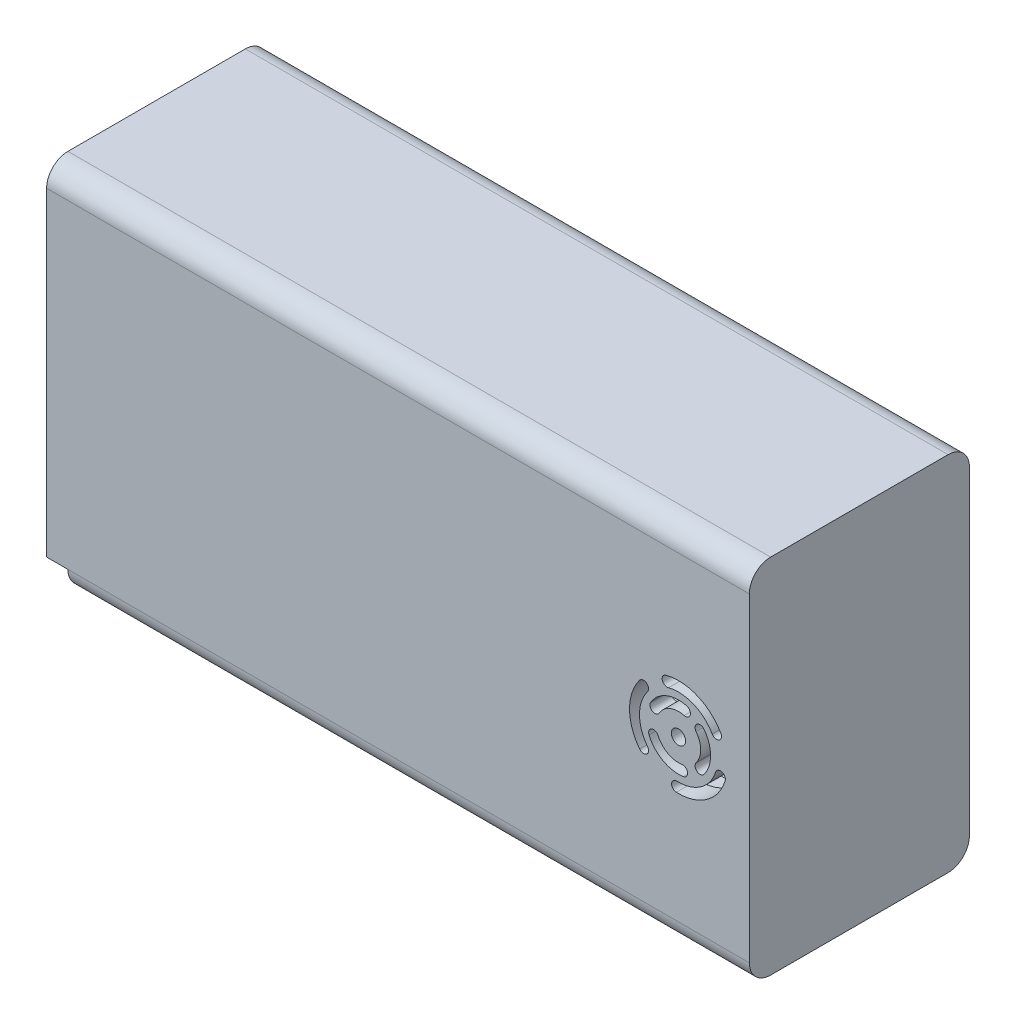
from build123d import *

# Parameters (mm, degrees)
SKETCH1_W           = 99
SKETCH1_H           = 51
BOSS_EXTRUDE2_DEPTH = 31
CUT_EXTRUDE1_DEPTH  = 96
SKETCH4_W           = 3
SKETCH4_H           = 31
CUT_EXTRUDE2_DEPTH  = 3
SKETCH6_W           = 2
SKETCH6_H           = 2
BOSS_EXTRUDE3_DEPTH = 96
SKETCH7_W           = 1
SKETCH7_H           = 1
CUT_EXTRUDE3_DEPTH  = 45
FILLET1_R           = 3
SKETCH9_R           = 1
SKETCH9_R_2         = 0.5
CUT_EXTRUDE4_DEPTH  = 10


with BuildPart() as part:
    # Sketch1 → Boss-Extrude2 (new body)
    with BuildSketch(Plane.XY):
        Rectangle(SKETCH1_W, SKETCH1_H)
    extrude(amount=BOSS_EXTRUDE2_DEPTH)

    # Sketch3 → Cut-Extrude1 (cut)
    with BuildSketch(Plane.ZY.offset(49.5)):
        Polygon((3, 0.616456183), (3, -22.5), (28, -22.5), (28, 22.5), (3, 22.5), align=None)
    extrude(amount=-CUT_EXTRUDE1_DEPTH, mode=Mode.SUBTRACT)

    # Sketch4 → Cut-Extrude2 (cut)
    with BuildSketch(Plane.XZ.offset(25.5)):
        with Locations((-48, 15.5)):
            Rectangle(SKETCH4_W, SKETCH4_H)
    extrude(amount=-CUT_EXTRUDE2_DEPTH, mode=Mode.SUBTRACT)

    # Sketch6 → Boss-Extrude3 (add)
    with BuildSketch(Plane.ZY.offset(46.5)):
        with Locations((13.2, -21.5)):
            Rectangle(SKETCH6_W, SKETCH6_H)
        with Locations((17.8, -21.5)):
            Rectangle(SKETCH6_W, SKETCH6_H)
        with Locations((13.2, 21.5)):
            Rectangle(SKETCH6_W, SKETCH6_H)
        with Locations((17.8, 21.5)):
            Rectangle(SKETCH6_W, SKETCH6_H)
    extrude(amount=-BOSS_EXTRUDE3_DEPTH)

    # Sketch7 → Cut-Extrude3 (cut)
    with BuildSketch(Plane.XZ.offset(22.5)):
        with Locations((-48.055142405, 28.5)):
            Rectangle(SKETCH7_W, SKETCH7_H)
        with Locations((-48.055142405, 2.5)):
            Rectangle(SKETCH7_W, SKETCH7_H)
    extrude(amount=-CUT_EXTRUDE3_DEPTH, mode=Mode.SUBTRACT)

    # Fillet1
    fillet1_edges = [part.edges().sort_by_distance(p)[0] for p in [
        (0, 25.5, 31),
        (1.5, -25.5, 31),
        (1.5, -25.5, 0),
        (0, 25.5, 0),
    ]]
    fillet(fillet1_edges, radius=FILLET1_R)

    # Sketch9 → Cut-Extrude4 (cut)
    # profile 1 of 8: a face of its own
    with BuildSketch(Plane(origin=(0, 0, 28), x_dir=(-1, 0, 0), z_dir=(0, 0, -1))):
        with BuildLine():
            ThreePointArc((-43.107346254, 2.807819217), (-44.043005412, 0.051456221), (-43.107346254, -2.704906774))
            ThreePointArc((-43.107346254, -2.704906774), (-42.125865916, -2.834121112), (-41.996651578, -1.852640773))
            ThreePointArc((-41.996651578, -1.852640773), (-42.643005412, 0.051456221), (-41.996651578, 1.955553216))
            ThreePointArc((-41.996651578, 1.955553216), (-42.125865916, 2.937033554), (-43.107346254, 2.807819217))
        make_face()
    # profile 2 of 8: a face of its own
    with BuildSketch(Plane(origin=(0, 0, 28), x_dir=(-1, 0, 0), z_dir=(0, 0, -1))):
        with BuildLine():
            ThreePointArc((-37.730978714, 6.710201232), (-42.153265918, 6.420349215), (-45.485251514, 3.498276272))
            ThreePointArc((-45.485251514, 3.498276272), (-45.229033732, 2.542058489), (-44.272815949, 2.798276272))
            ThreePointArc((-44.272815949, 2.798276272), (-41.617509112, 5.12691787), (-38.093325377, 5.357905075))
            ThreePointArc((-38.093325377, 5.357905075), (-37.236003967, 5.852879822), (-37.730978714, 6.710201232))
        make_face()
    # profile 3 of 8: a face of its own
    with BuildSketch(Plane(origin=(0, 0, 28), x_dir=(-1, 0, 0), z_dir=(0, 0, -1))):
        with BuildLine():
            ThreePointArc((-35.59397575, 2.315366896), (-35.850193532, 1.359149114), (-36.806411315, 1.615366896))
            ThreePointArc((-36.806411315, 1.615366896), (-38.318218652, 2.941186348), (-40.324723797, 3.072699643))
            ThreePointArc((-40.324723797, 3.072699643), (-41.182045207, 3.56767439), (-40.68707046, 4.4249958))
            ThreePointArc((-40.68707046, 4.4249958), (-37.782461847, 4.234617693), (-35.59397575, 2.315366896))
        make_face()
    # profile 4 of 8: a face of its own
    with BuildSketch(Plane(origin=(0, 0, 28), x_dir=(-1, 0, 0), z_dir=(0, 0, -1))):
        with BuildLine():
            ThreePointArc((-34.046091661, -4.145125978), (-32.621543961, 0.051456221), (-34.046091661, 4.24803842))
            ThreePointArc((-34.046091661, 4.24803842), (-35.027572, 4.377252758), (-35.156786338, 3.39577242))
            ThreePointArc((-35.156786338, 3.39577242), (-34.021543961, 0.051456221), (-35.156786338, -3.292859977))
            ThreePointArc((-35.156786338, -3.292859977), (-35.027572, -4.274340315), (-34.046091661, -4.145125978))
        make_face()
    # profile 5 of 8: a face of its own
    with BuildSketch(Plane(origin=(0, 0, 28), x_dir=(-1, 0, 0), z_dir=(0, 0, -1))):
        with BuildLine():
            ThreePointArc((-40.203971578, -4.423668127), (-37.337352845, -3.918205901), (-35.370817206, -1.772108839))
            ThreePointArc((-35.370817206, -1.772108839), (-35.729612558, -0.849468121), (-36.652253276, -1.208263474))
            ThreePointArc((-36.652253276, -1.208263474), (-38.010737122, -2.690788443), (-39.990998837, -3.039962012))
            ThreePointArc((-39.990998837, -3.039962012), (-40.789338265, -3.625328699), (-40.203971578, -4.423668127))
        make_face()
    # profile 6 of 8: a face of its own
    with BuildSketch(Plane(origin=(0, 0, 28), x_dir=(-1, 0, 0), z_dir=(0, 0, -1))):
        with BuildLine():
            ThreePointArc((-46.089765479, -2.021501337), (-45.632657673, -1.143405411), (-44.754561748, -1.600513217))
            ThreePointArc((-44.754561748, -1.600513217), (-42.666206574, -4.448670298), (-39.275554847, -5.436955151))
            ThreePointArc((-39.275554847, -5.436955151), (-38.54568752, -6.105755335), (-39.214487704, -6.835622662))
            ThreePointArc((-39.214487704, -6.835622662), (-43.469213585, -5.59548316), (-46.089765479, -2.021501337))
        make_face()
    # profile 7 of 8: a face of its own
    with BuildSketch(Plane(origin=(0, 0, 28), x_dir=(-1, 0, 0), z_dir=(0, 0, -1))):
        with Locations((-39.515184062, 0.051456221)):
            Circle(SKETCH9_R)
        with Locations((-39.515184062, 0.051456221)):
            Circle(SKETCH9_R_2, mode=Mode.SUBTRACT)
    # profile 8 of 8: a face of its own
    with BuildSketch(Plane(origin=(0, 0, 28), x_dir=(-1, 0, 0), z_dir=(0, 0, -1))):
        with Locations((-39.515184062, 0.051456221)):
            Circle(SKETCH9_R_2)
    extrude(amount=-CUT_EXTRUDE4_DEPTH, mode=Mode.SUBTRACT)


solid = part.part
